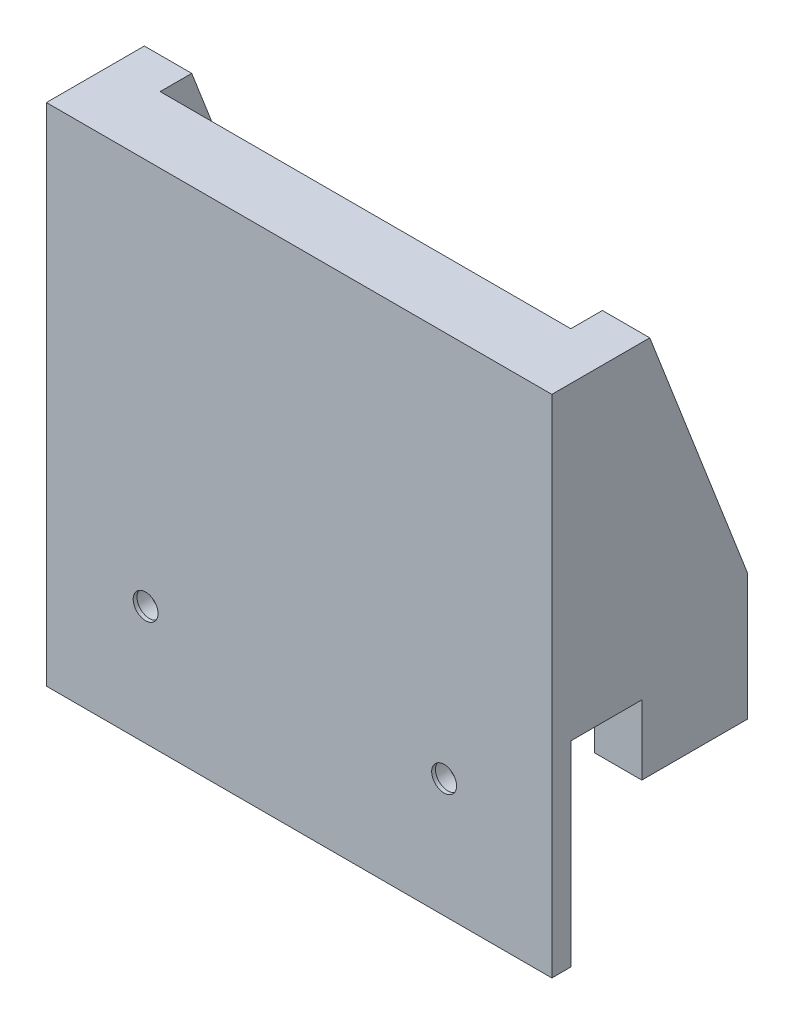
from build123d import *

# Parameters (mm, degrees)
SKETCH1_W                       = 101.6
SKETCH1_H                       = 101.6
BOSS_EXTRUDE1_DEPTH             = 3.81
M6X1_0_TAPPED_HOLE1_D           = 5
M6X1_0_TAPPED_HOLE1_CBORE_D     = 6
M6X1_0_TAPPED_HOLE1_CBORE_DEPTH = 3.048
SKETCH4_W                       = 101.6
SKETCH4_H                       = 62.23
BOSS_EXTRUDE2_DEPTH             = 9.525
BOSS_EXTRUDE3_DEPTH             = 9.525
BOSS_EXTRUDE4_DEPTH             = 9.525


with BuildPart() as part:
    # Sketch1 → Boss-Extrude1 (new body)
    with BuildSketch(Plane.XY):
        with Locations((-50.8, 50.8)):
            Rectangle(SKETCH1_W, SKETCH1_H)
    extrude(amount=BOSS_EXTRUDE1_DEPTH)

    # M6x1.0 Tapped Hole1 (through all)
    with Locations(Plane(origin=(-50.8, -38.1, 0), x_dir=(-1, 0, 0), z_dir=(0, 0, -1))):
        with Locations((-29.14300736, 61.964884424), (30.859893074, 61.964884424)):
            CounterBoreHole(M6X1_0_TAPPED_HOLE1_D / 2, M6X1_0_TAPPED_HOLE1_CBORE_D / 2, M6X1_0_TAPPED_HOLE1_CBORE_DEPTH)

    # Sketch4 → Boss-Extrude2 (add)
    with BuildSketch(Plane(origin=(0, 0, 0), x_dir=(-1, 0, 0), z_dir=(0, 0, -1))):
        with Locations((50.8, 70.485)):
            Rectangle(SKETCH4_W, SKETCH4_H)
    extrude(amount=BOSS_EXTRUDE2_DEPTH)

    # Sketch5 → Boss-Extrude3 (add)
    with BuildSketch(Plane(origin=(0, 0, 0), x_dir=(0, 0, -1), z_dir=(1, 0, 0))):
        Polygon((9.525, 101.6), (15.875, 101.6), (35.534233385, 50.8), (35.534233385, 25.4), (14.2748, 25.4), (14.2748, 39.37), (9.525, 39.37), align=None)
    extrude(amount=-BOSS_EXTRUDE3_DEPTH)

    # Sketch6 → Boss-Extrude4 (add)
    with BuildSketch(Plane.ZY.offset(101.6)):
        Polygon((-9.525, 39.37), (-9.525, 101.6), (-15.875, 101.6), (-35.534233385, 50.8), (-35.534233385, 25.4), (-14.2748, 25.4), (-14.2748, 39.37), align=None)
    extrude(amount=-BOSS_EXTRUDE4_DEPTH)


solid = part.part
